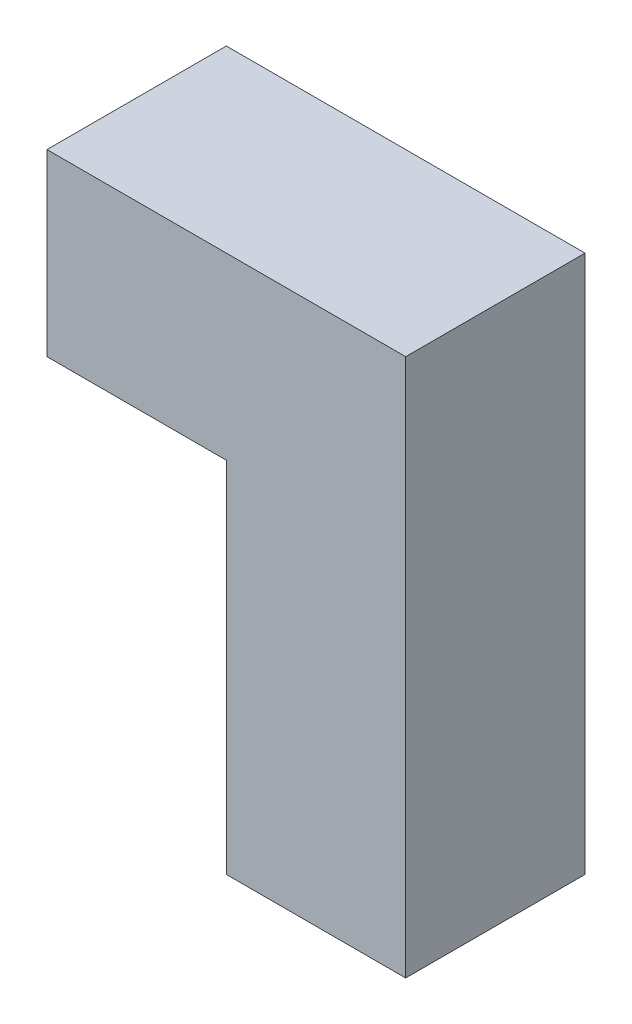
from build123d import *

# Parameters (mm, degrees)
BOSS_EXTRUDE1_DEPTH = 19.05


with BuildPart() as part:
    # Sketch1 → Boss-Extrude1 (new body)
    with BuildSketch(Plane.XY):
        Polygon((0, 0), (0, 19.05), (38.1, 19.05), (38.1, -38.1), (19.05, -38.1), (19.05, 0), align=None)
    extrude(amount=BOSS_EXTRUDE1_DEPTH)


solid = part.part
